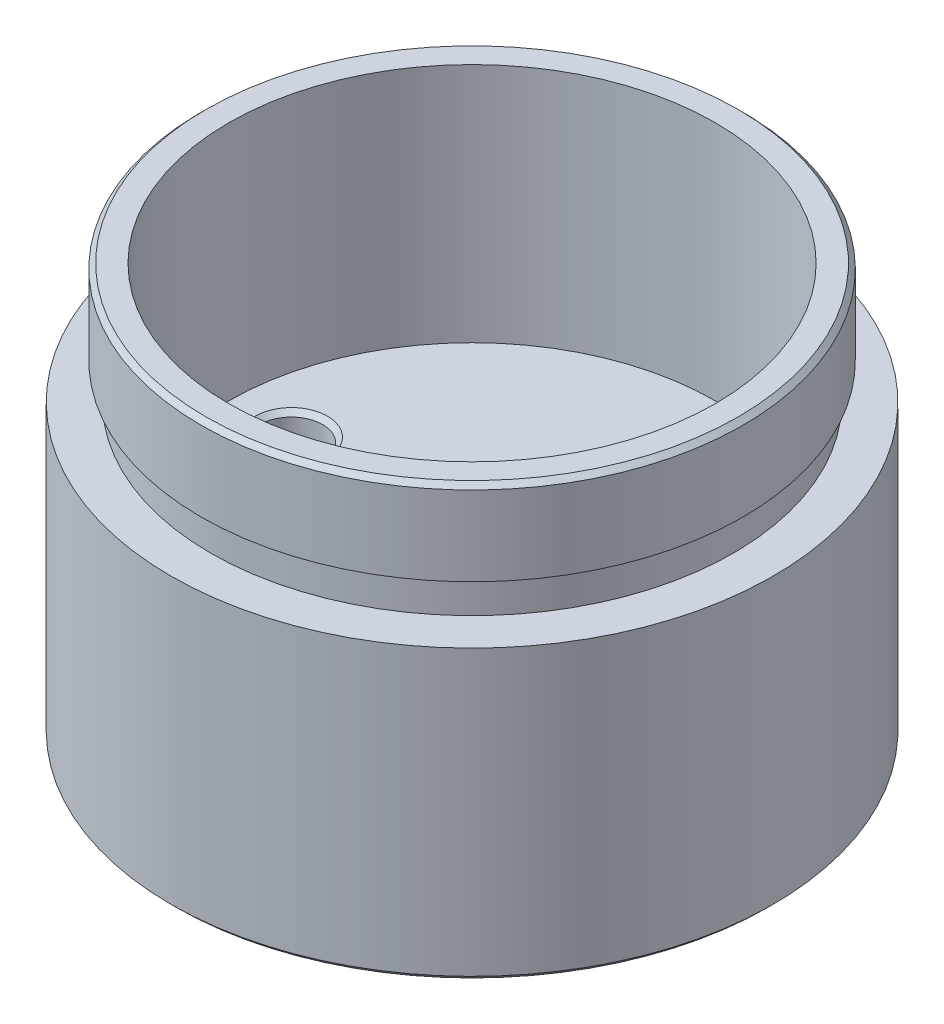
from build123d import *

# Parameters (mm, degrees)
SKETCH1_R           = 12.5
BOSS_EXTRUDE1_DEPTH = 17
SKETCH2_R           = 10.1
CUT_EXTRUDE1_DEPTH  = 10
SKETCH3_R           = 1.3
CUT_EXTRUDE2_DEPTH  = 10
CUT_EXTRUDE3_START  = -5
SKETCH4_R           = 12.5
SKETCH4_R_2         = 10.85
CUT_EXTRUDE3_DEPTH  = 5
BOSS_EXTRUDE2_START = -3.5
SKETCH7_R           = 11.25
SKETCH7_R_2         = 10.85
BOSS_EXTRUDE2_DEPTH = 3.5
CHAMFER1_SIZE       = 0.2


with BuildPart() as part:
    # Sketch1 → Boss-Extrude1 (new body)
    with BuildSketch(Plane(origin=(0, 0, 0), x_dir=(1, 0, 0), z_dir=(0, 1, 0))):
        with Locations(Location((0, 0, 0), (0, 0, 270))):
            Circle(SKETCH1_R)
    extrude(amount=BOSS_EXTRUDE1_DEPTH)

    # Sketch2 → Cut-Extrude1 (cut)
    with BuildSketch(Plane(origin=(0, 17, 0), x_dir=(1, 0, 0), z_dir=(0, 1, 0))):
        with Locations(Location((0, 0, 0), (0, 0, 270))):
            Circle(SKETCH2_R)
    extrude(amount=-CUT_EXTRUDE1_DEPTH, mode=Mode.SUBTRACT)

    # Sketch3 → Cut-Extrude2 (cut)
    with BuildSketch(Plane(origin=(0, 7, 0), x_dir=(1, 0, 0), z_dir=(0, 1, 0))):
        with Locations(Location((7.5, 0, 0), (0, 0, 270))):
            Circle(SKETCH3_R)
        with Locations(Location((-7.5, 0, 0), (0, 0, 270))):
            Circle(SKETCH3_R)
    extrude(amount=-CUT_EXTRUDE2_DEPTH, mode=Mode.SUBTRACT)

    # Sketch4 → Cut-Extrude3 (cut)
    with BuildSketch(Plane(origin=(0, 17, 0), x_dir=(1, 0, 0), z_dir=(0, 1, 0)).offset(CUT_EXTRUDE3_START)):
        with Locations(Location((0, 0, 0), (0, 0, 270))):
            Circle(SKETCH4_R)
        with Locations(Location((0, 0, 0), (0, 0, 270))):
            Circle(SKETCH4_R_2, mode=Mode.SUBTRACT)
    extrude(amount=CUT_EXTRUDE3_DEPTH, mode=Mode.SUBTRACT)

    # Sketch7 → Boss-Extrude2 (add)
    with BuildSketch(Plane(origin=(0, 17, 0), x_dir=(1, 0, 0), z_dir=(0, 1, 0)).offset(BOSS_EXTRUDE2_START)):
        with Locations(Location((0, 0, 0), (0, 0, 270))):
            Circle(SKETCH7_R)
        with Locations(Location((0, 0, 0), (0, 0, 270))):
            Circle(SKETCH7_R_2, mode=Mode.SUBTRACT)
    extrude(amount=BOSS_EXTRUDE2_DEPTH)

    # Chamfer1
    chamfer1_edges = [part.edges().sort_by_distance(p)[0] for p in [
        (7.5, 0, -1.3),
        (7.5, 7, -1.3),
        (-7.5, 0, -1.3),
        (-7.5, 7, -1.3),
        (0, 0, -12.5),
        (0, 17, -11.25),
    ]]
    chamfer(chamfer1_edges, length=CHAMFER1_SIZE)


solid = part.part
